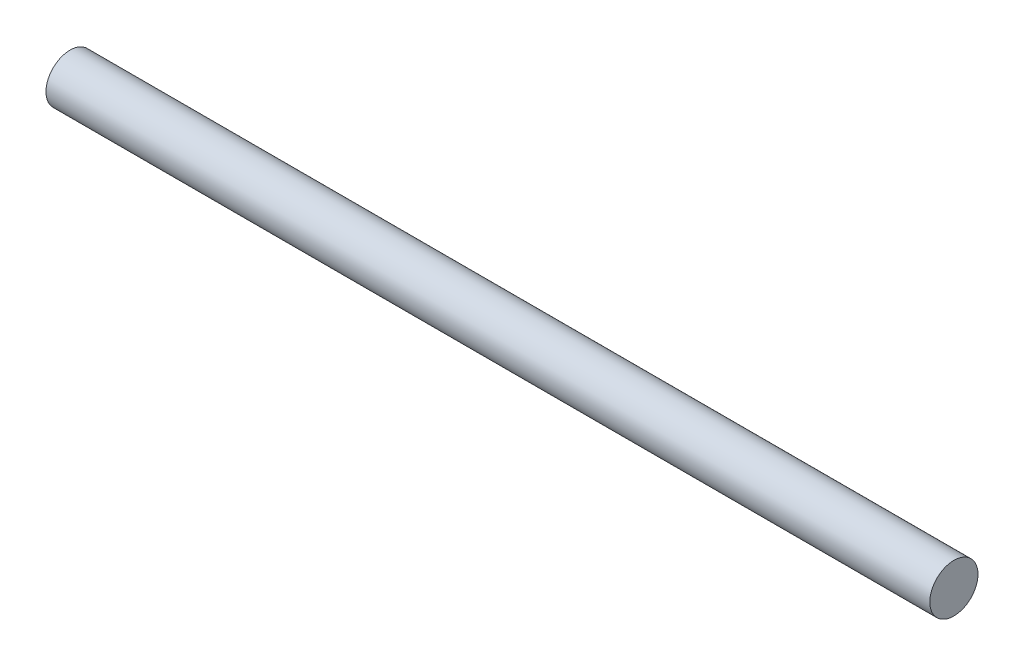
from build123d import *

# Parameters (mm, degrees)
SKETCH1_R           = 1.5
BOSS_EXTRUDE1_DEPTH = 55


with BuildPart() as part:
    # Sketch1 → Boss-Extrude1 (new body)
    with BuildSketch(Plane(origin=(0, 0, 0), x_dir=(0, 0, -1), z_dir=(1, 0, 0))):
        Circle(SKETCH1_R)
    extrude(amount=BOSS_EXTRUDE1_DEPTH)


solid = part.part
